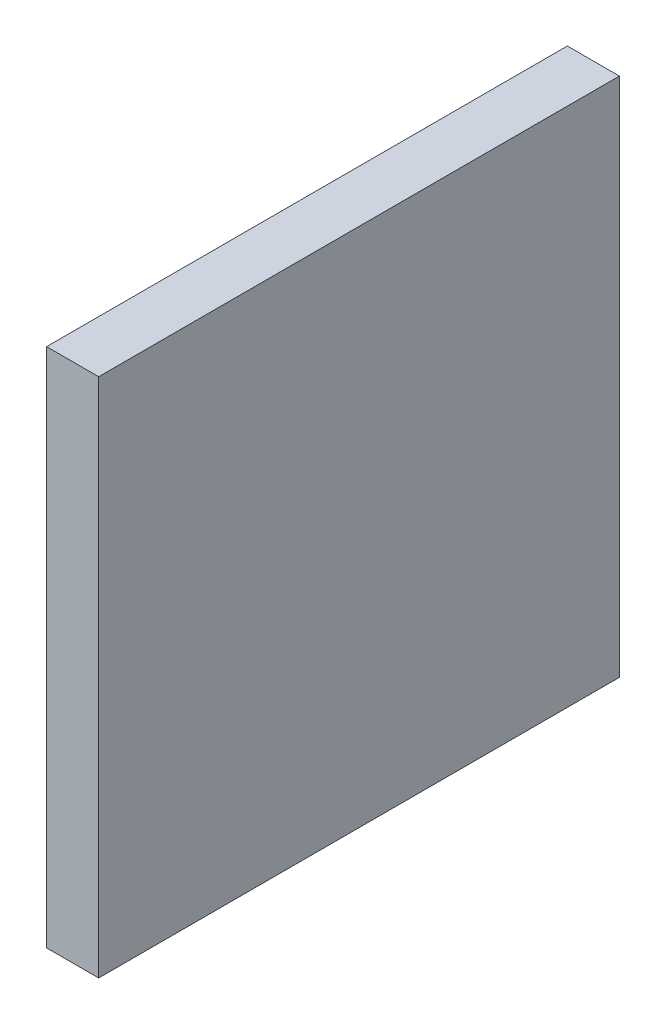
from build123d import *

# Parameters (mm, degrees)
SKETCH1_W           = 100
SKETCH1_H           = 1000
BOSS_EXTRUDE1_DEPTH = 1000


with BuildPart() as part:
    # Sketch1 → Boss-Extrude1 (new body)
    with BuildSketch(Plane(origin=(0, 0, 0), x_dir=(1, 0, 0), z_dir=(0, 1, 0))):
        Rectangle(SKETCH1_W, SKETCH1_H)
    extrude(amount=BOSS_EXTRUDE1_DEPTH)


solid = part.part
